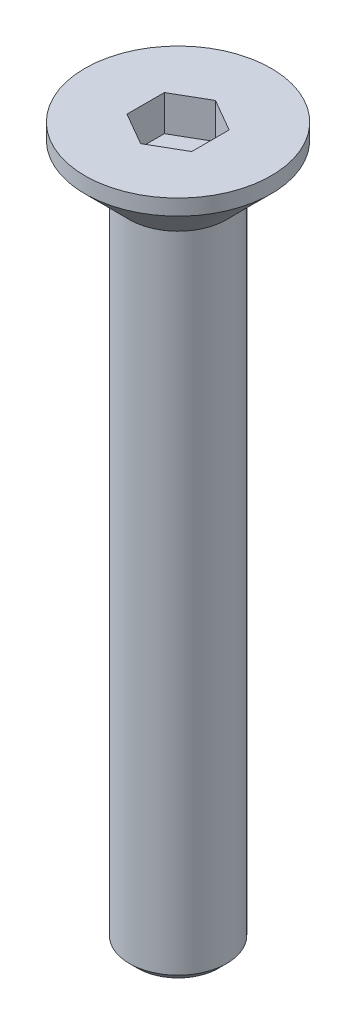
from build123d import *

# Parameters (mm, degrees)
CUT_EXTRUDE1_DEPTH = 1.1


with BuildPart() as part:
    # Sketch1 → Revolve1 (revolve)
    with BuildSketch(Plane.XY):
        Polygon((0, 0), (0, -22), (-1.25, -22), (-1.5, -21.75), (-1.5, -1.86), (-2.875, -0.485), (-2.875, 0), align=None)
    revolve(axis=Axis((0, 0, 0), (0, -1, 0)))

    # Sketch2 → Cut-Extrude1 (cut)
    with BuildSketch(Plane(origin=(0, 0, 0), x_dir=(1, 0, 0), z_dir=(0, 1, 0))):
        Polygon((-1, 0.577350269), (-1, -0.577350269), (0, -1.154700538), (1, -0.577350269), (1, 0.577350269), (0, 1.154700538), align=None)
    extrude(amount=-CUT_EXTRUDE1_DEPTH, mode=Mode.SUBTRACT)


solid = part.part
